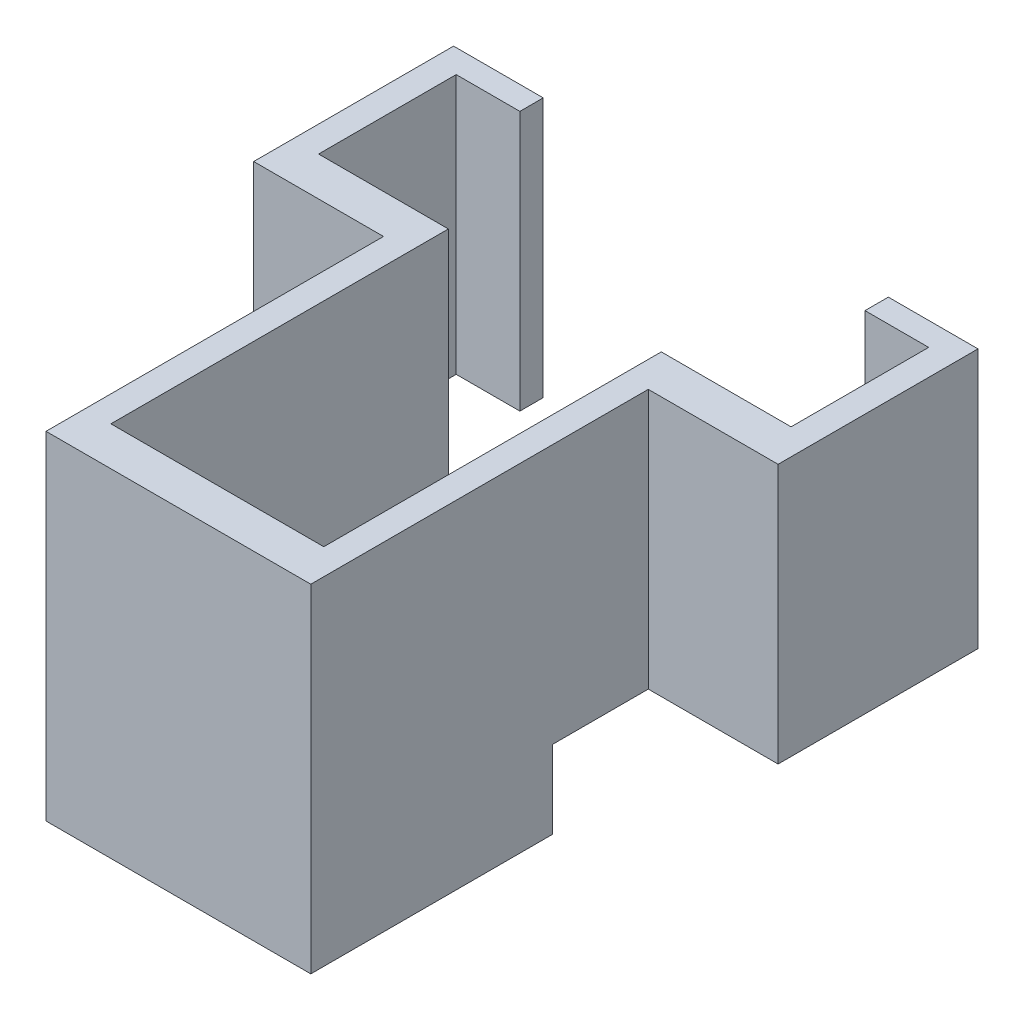
from build123d import *

# Parameters (mm, degrees)
BOSS_EXTRUDE1_DEPTH     = 13
CUT_EXTRUDE1_DEPTH      = 32.130049791
CUT_EXTRUDE1_DEPTH_BACK = 32.130049791
SKETCH2_W               = 11.385886766
SKETCH2_H               = 3


with BuildPart() as part:
    # Sketch1 → Boss-Extrude1 (new body)
    with BuildSketch(Plane(origin=(0, 0, 0), x_dir=(1, 0, 0), z_dir=(0, 1, 0))):
        Polygon((2.453447834, -5.3), (-2.546552166, -5.3), (-2.546552166, -18.3), (-10.746552166, -18.3), (-10.746552166, -5.3), (-15.746552166, -5.3), (-15.746552166, 0), (-13.293104332, 0), (-13.293104332, 0.9), (-16.746552166, 0.9), (-16.746552166, -6.8), (-11.746552166, -6.8), (-11.746552166, -19.8), (-1.546552166, -19.8), (-1.546552166, -6.8), (3.453447834, -6.8), (3.453447834, 0.9), (0, 0.9), (0, 0), (2.453447834, 0), align=None)
    extrude(amount=BOSS_EXTRUDE1_DEPTH)

    # Sketch2 → Cut-Extrude1 (cut, two sides: drawn at the far end of the back side and taken through both)
    with BuildSketch(Plane.ZY.offset(16.746552166).offset(-CUT_EXTRUDE1_DEPTH_BACK)):
        with Locations((4.792943383, 1.5)):
            Rectangle(SKETCH2_W, SKETCH2_H)
    extrude(amount=CUT_EXTRUDE1_DEPTH + CUT_EXTRUDE1_DEPTH_BACK, mode=Mode.SUBTRACT)


solid = part.part
